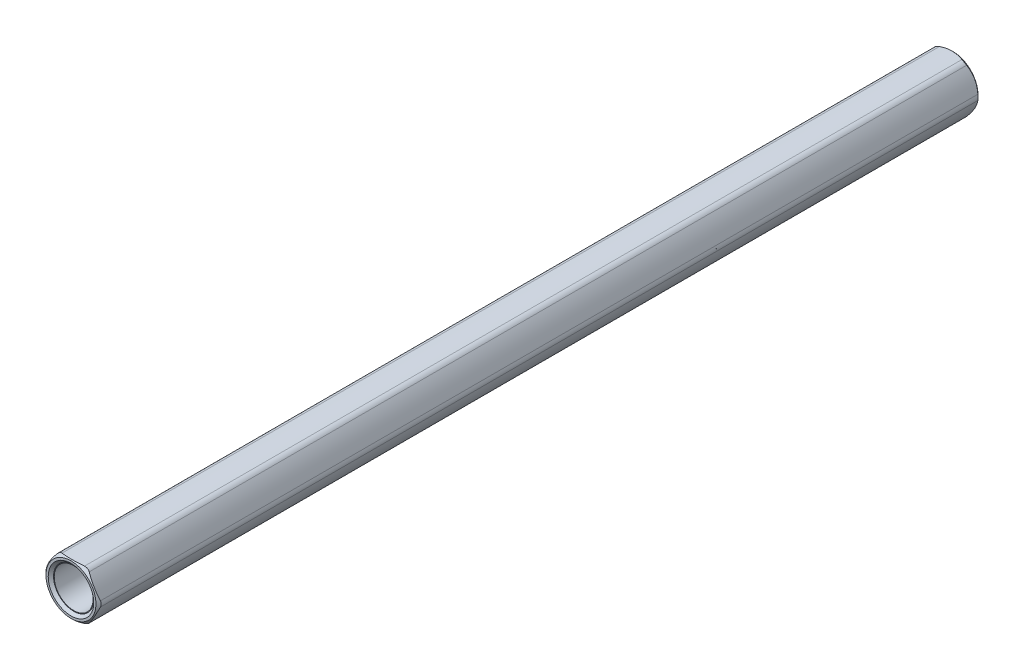
from build123d import *

# Parameters (mm, degrees)
ESBO_O3_R       = 2.9
EXTRUS_O2_DEPTH = 65.85


with BuildPart() as part:
    # Esboço3 → Extrusão2 (new, symmetric)
    with BuildSketch(Plane.XY):
        with BuildLine():
            ThreePointArc((-1.679123513, 3.708327237), (-2.061437209, 3.570513982), (-2.371943836, 3.308327237))
            ThreePointArc((-2.371943836, 3.308327237), (-3.334197805, 1.925), (-4.05106735, 0.4))
            ThreePointArc((-4.05106735, 0.4), (-4.122874417, 0), (-4.05106735, -0.4))
            ThreePointArc((-4.05106735, -0.4), (-3.334197805, -1.925), (-2.371943836, -3.308327237))
            ThreePointArc((-2.371943836, -3.308327237), (-2.061437209, -3.570513982), (-1.679123513, -3.708327237))
            ThreePointArc((-1.679123513, -3.708327237), (0, -3.85), (1.679123513, -3.708327237))
            ThreePointArc((1.679123513, -3.708327237), (2.061437209, -3.570513982), (2.371943836, -3.308327237))
            ThreePointArc((2.371943836, -3.308327237), (3.334197805, -1.925), (4.05106735, -0.4))
            ThreePointArc((4.05106735, -0.4), (4.122874417, 0), (4.05106735, 0.4))
            ThreePointArc((4.05106735, 0.4), (3.334197805, 1.925), (2.371943836, 3.308327237))
            ThreePointArc((2.371943836, 3.308327237), (2.061437209, 3.570513982), (1.679123513, 3.708327237))
            ThreePointArc((1.679123513, 3.708327237), (0, 3.85), (-1.679123513, 3.708327237))
        make_face()
        Circle(ESBO_O3_R, mode=Mode.SUBTRACT)
    extrude(amount=EXTRUS_O2_DEPTH, both=True)

    # Esboço5 → Corte-Revolução2 (revolve, cut)
    with BuildSketch(Plane(origin=(0, 0, 0), x_dir=(0, 0, -1), z_dir=(1, 0, 0))):
        Polygon((65.85, 3.73), (65.124884733, 4.455115267), (66.124884733, 4.455115267), (66.124884733, 3.73), align=None)
        Polygon((65.85, 3.4), (65.45, 3), (65.45, 2.769529571), (65.85, 2.769529571), align=None)
        Polygon((-65.85, 3.73), (-66.124884733, 3.73), (-66.124884733, 4.455115267), (-65.124884733, 4.455115267), align=None)
    corte_revolu_o2 = revolve(axis=Axis((0, 0, -65.739939352), (0, 0, 1)), mode=Mode.SUBTRACT)

    # Espelhar1: Corte-Revolução2 across plane
    add(corte_revolu_o2.mirror(Plane.XY), mode=Mode.SUBTRACT)


solid = part.part
